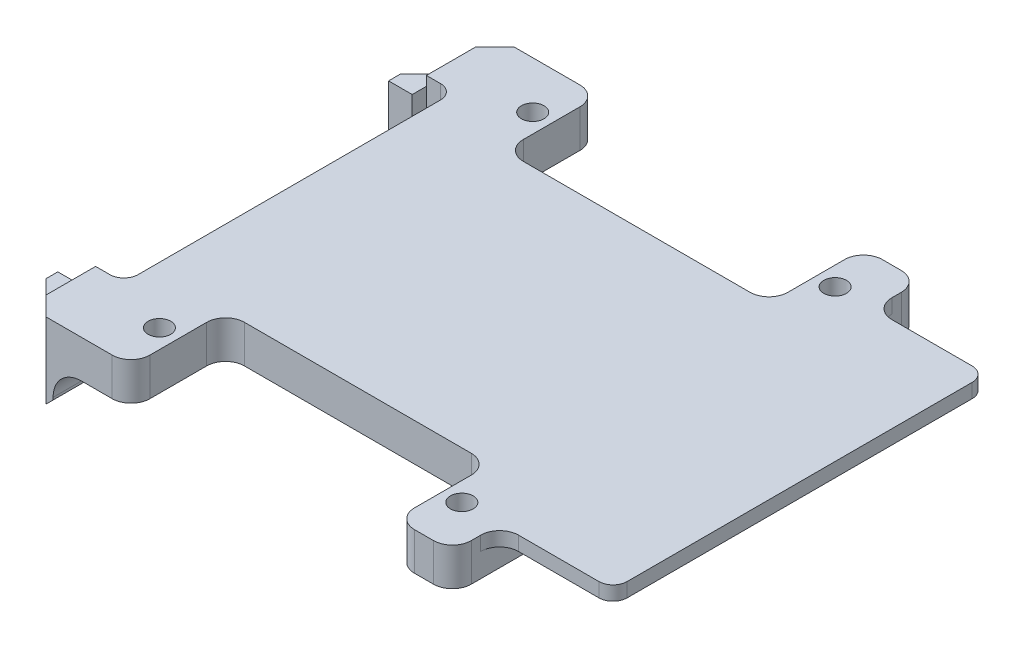
from build123d import *

# Parameters (mm, degrees)
BOSS_EXTRUDE1_DEPTH  = 19.75
SKETCH2_W            = 28
SKETCH2_H            = 5
CUT_EXTRUDE1_DEPTH   = 39.25
SKETCH3_W            = 6
SKETCH3_H            = 5
BOSS_EXTRUDE2_DEPTH  = 4
BOSS_EXTRUDE4_DEPTH  = 5
BOSS_EXTRUDE5_START  = -5
BOSS_EXTRUDE5_DEPTH  = 5
CHAMFER2_SIZE        = 2
FILLET1_R            = 2
CUT_EXTRUDE3_DEPTH   = 42.337785379
BOSS_EXTRUDE6_DEPTH  = 6
FILLET2_R            = 1.5
SKETCH11_R           = 2.5
SKETCH11_R_2         = 1
BOSS_EXTRUDE7_DEPTH  = 10.5
FILLET3_R            = 1
FILLET4_R            = 1.5
SKETCH13_W           = 6
SKETCH13_H           = 7
BOSS_EXTRUDE8_DEPTH  = 2.5
SKETCH14_R           = 1.2
CUT_EXTRUDE6_DEPTH   = 42.237877006
BOSS_EXTRUDE9_DEPTH  = 2.5
FILLET5_R            = 2
SKETCH18_W           = 1.5
SKETCH18_H           = 1.5
BOSS_EXTRUDE10_DEPTH = 0.75
SKETCH19_W           = 1.5
SKETCH19_H           = 1.5
BOSS_EXTRUDE11_DEPTH = 0.75


with BuildPart() as part:
    # Sketch1 → Boss-Extrude1 (new, symmetric)
    with BuildSketch(Plane.XY):
        Polygon((-25, 24), (32, 24), (32, 22.5), (-23.5, 22.5), (-23.5, 15.5), (-26.5, 15.5), (-26.5, 17), (-25, 17), align=None)
    extrude(amount=BOSS_EXTRUDE1_DEPTH, both=True)

    # Sketch2 → Cut-Extrude1 (cut, through all)
    with BuildSketch(Plane.XZ.offset(-22.5)):
        with Locations((0, 17.25)):
            Rectangle(SKETCH2_W, SKETCH2_H)
        with Locations((0, -17.25)):
            Rectangle(SKETCH2_W, SKETCH2_H)
    extrude(amount=-CUT_EXTRUDE1_DEPTH, mode=Mode.SUBTRACT)

    # Sketch3 → Boss-Extrude2 (add)
    with BuildSketch(Plane(origin=(0, 24, 0), x_dir=(1, 0, 0), z_dir=(0, 1, 0))):
        with Locations((-17, 22.25)):
            Rectangle(SKETCH3_W, SKETCH3_H)
        with Locations((17, 22.25)):
            Rectangle(SKETCH3_W, SKETCH3_H)
        with Locations((17, -22.25)):
            Rectangle(SKETCH3_W, SKETCH3_H)
        with Locations((-17, -22.25)):
            Rectangle(SKETCH3_W, SKETCH3_H)
    extrude(amount=-BOSS_EXTRUDE2_DEPTH)

    # Sketch6 → Boss-Extrude4 (add)
    with BuildSketch(Plane(origin=(0, 0, -24.75), x_dir=(-1, 0, 0), z_dir=(0, 0, -1))):
        with BuildLine():
            Line((20, 24), (25, 24))
            Line((25, 24), (25, 15.5))
            Line((25, 15.5), (23.5, 15.5))
            Line((23.5, 15.5), (22.25, 16.75))
            Line((22.25, 16.75), (22.25, 17))
            ThreePointArc((22.25, 17), (21.371320344, 19.121320344), (19.25, 20))
            Line((19.25, 20), (20, 20))
            Line((20, 20), (20, 24))
        make_face()
    extrude(amount=-BOSS_EXTRUDE4_DEPTH)

    # Sketch7 → Boss-Extrude5 (add)
    with BuildSketch(Plane.XY.offset(24.75).offset(BOSS_EXTRUDE5_START)):
        with BuildLine():
            Line((-20, 20), (-20, 24))
            Line((-20, 24), (-25, 24))
            Line((-25, 24), (-25, 15.5))
            Line((-25, 15.5), (-23.5, 15.5))
            Line((-23.5, 15.5), (-22.25, 16.75))
            Line((-22.25, 16.75), (-22.25, 17))
            ThreePointArc((-22.25, 17), (-21.371320344, 19.121320344), (-19.25, 20))
            Line((-19.25, 20), (-20, 20))
        make_face()
    extrude(amount=BOSS_EXTRUDE5_DEPTH)

    # Chamfer2
    chamfer2_edges = [part.edges().sort_by_distance(p)[0] for p in [
        (-25, 19.75, -24.75),
        (-25, 19.75, 24.75),
    ]]
    chamfer(chamfer2_edges, length=CHAMFER2_SIZE)

    # Fillet1
    fillet1_edges = [part.edges().sort_by_distance(p)[0] for p in [
        (14, 23.25, 14.75),
        (-14, 23.25, 14.75),
        (-14, 23.25, -14.75),
        (14, 23.25, -14.75),
        (14, 22, 24.75),
        (20, 23.25, 19.75),
        (20, 22, 24.75),
        (-14, 22, 24.75),
        (20, 23.25, -19.75),
        (14, 22, -24.75),
        (20, 22, -24.75),
        (-14, 22, -24.75),
    ]]
    fillet(fillet1_edges, radius=FILLET1_R)

    # Sketch8 → Cut-Extrude3 (cut, through all)
    with BuildSketch(Plane(origin=(0, 24, 0), x_dir=(1, 0, 0), z_dir=(0, 1, 0))):
        Polygon((-25, 17.5), (-22, 17.5), (-22, -17.5), (-25, -17.5), (-26.867861181, -17.5), (-26.867861181, 17.5), align=None)
    extrude(amount=-CUT_EXTRUDE3_DEPTH, mode=Mode.SUBTRACT)

    # Sketch9 → Boss-Extrude6 (add)
    with BuildSketch(Plane.XZ.offset(-15.5)):
        Polygon((-25, 22.75), (-29, 18.75), (-29, 17.5), (-26.5, 17.5), (-26.5, 20.5), (-25, 20.5), align=None)
        Polygon((-25, -20.5), (-25, -22.75), (-29, -18.75), (-29, -17.5), (-26.5, -17.5), (-26.5, -20.5), align=None)
    extrude(amount=-BOSS_EXTRUDE6_DEPTH)

    # Fillet2
    fillet2_edges = [part.edges().sort_by_distance(p)[0] for p in [
        (-25, 21.5, 21.625),
        (-25, 21.5, -21.625),
    ]]
    fillet(fillet2_edges, radius=FILLET2_R)

    # Sketch11 → Boss-Extrude7 (add)
    # profile 1 of 2: a face of its own
    with BuildSketch(Plane.XZ.offset(-22.5)):
        with Locations(Location((10, 0, 0), (0, 0, 90))):
            Circle(SKETCH11_R)
        with Locations(Location((10, 0, 0), (0, 0, 90))):
            Circle(SKETCH11_R_2, mode=Mode.SUBTRACT)
    # profile 2 of 2: a face of its own
    with BuildSketch(Plane.XZ.offset(-22.5)):
        with Locations(Location((-10, 0, 0), (0, 0, 90))):
            Circle(SKETCH11_R)
        with Locations(Location((-10, 0, 0), (0, 0, 90))):
            Circle(SKETCH11_R_2, mode=Mode.SUBTRACT)
    extrude(amount=BOSS_EXTRUDE7_DEPTH)

    # Fillet3
    fillet3_edges = [part.edges().sort_by_distance(p)[0] for p in [
        (10, 22.5, -2.5),
        (-10, 22.5, -2.5),
    ]]
    fillet(fillet3_edges, radius=FILLET3_R)

    # Fillet4
    fillet4_edges = [part.edges().sort_by_distance(p)[0] for p in [
        (32, 23.25, -19.75),
        (32, 23.25, 19.75),
        (-22, 23.25, -17.5),
        (-22, 23.25, 17.5),
    ]]
    fillet(fillet4_edges, radius=FILLET4_R)

    # Sketch13 → Boss-Extrude8 (add)
    with BuildSketch(Plane.XZ.offset(-22.5)):
        with Locations((17, 16.25)):
            Rectangle(SKETCH13_W, SKETCH13_H)
        with Locations((17, -16.25)):
            Rectangle(SKETCH13_W, SKETCH13_H)
        with Locations((-17, -16.25)):
            Rectangle(SKETCH13_W, SKETCH13_H)
        with Locations((-17, 16.25)):
            Rectangle(SKETCH13_W, SKETCH13_H)
    extrude(amount=BOSS_EXTRUDE8_DEPTH)

    # Sketch14 → Cut-Extrude6 (cut, through all)
    with BuildSketch(Plane.XZ.offset(-20)):
        with Locations((16, 19.75)):
            Circle(SKETCH14_R)
        with Locations(Location((-16, 19.75, 0), (0, 0, 180))):
            Circle(SKETCH14_R)
        with Locations((-16, -19.75)):
            Circle(SKETCH14_R)
        with Locations(Location((16, -19.75, 0), (0, 0, 180))):
            Circle(SKETCH14_R)
    extrude(amount=-CUT_EXTRUDE6_DEPTH, mode=Mode.SUBTRACT)

    # Sketch15 → Boss-Extrude9 (add)
    with BuildSketch(Plane.XZ.offset(-22.5)):
        with BuildLine():
            Line((14, 16.75), (14, 12.75))
            Line((14, 12.75), (-14, 12.75))
            Line((-14, 12.75), (-14, 16.75))
            ThreePointArc((-14, 16.75), (-13.414213562, 15.335786438), (-12, 14.75))
            Line((-12, 14.75), (12, 14.75))
            ThreePointArc((12, 14.75), (13.414213562, 15.335786438), (14, 16.75))
        make_face()
        with BuildLine():
            Line((-14, -12.75), (14, -12.75))
            Line((14, -12.75), (14, -16.75))
            ThreePointArc((14, -16.75), (13.414213562, -15.335786438), (12, -14.75))
            Line((12, -14.75), (-12, -14.75))
            ThreePointArc((-12, -14.75), (-13.414213562, -15.335786438), (-14, -16.75))
            Line((-14, -16.75), (-14, -12.75))
        make_face()
    extrude(amount=BOSS_EXTRUDE9_DEPTH)

    # Fillet5
    fillet5_edges = [part.edges().sort_by_distance(p)[0] for p in [
        (20, 21.25, 12.75),
        (20, 21.25, -12.75),
        (-20, 21.25, -12.75),
        (-20, 21.25, 12.75),
    ]]
    fillet(fillet5_edges, radius=FILLET5_R)

    # Sketch18 → Boss-Extrude10 (add)
    with BuildSketch(Plane.XY.offset(19.75)):
        with Locations((-25.75, 16.25)):
            Rectangle(SKETCH18_W, SKETCH18_H)
    extrude(amount=BOSS_EXTRUDE10_DEPTH)

    # Sketch19 → Boss-Extrude11 (add)
    with BuildSketch(Plane(origin=(0, 0, -19.75), x_dir=(-1, 0, 0), z_dir=(0, 0, -1))):
        with Locations((25.75, 16.25)):
            Rectangle(SKETCH19_W, SKETCH19_H)
    extrude(amount=BOSS_EXTRUDE11_DEPTH)


solid = part.part
